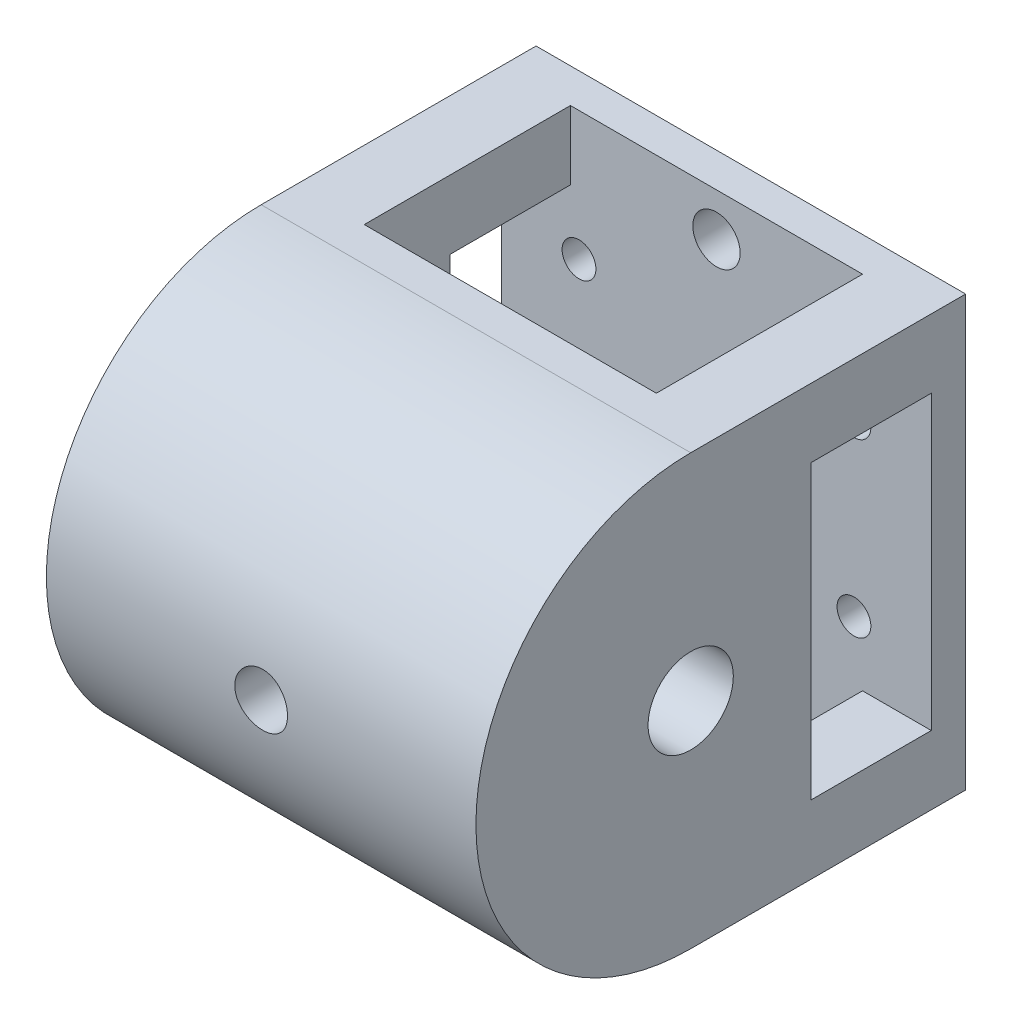
from build123d import *

# Parameters (mm, degrees)
SKETCH1_R               = 3.15
BOSS_EXTRUDE1_DEPTH     = 31.75
SKETCH4_W               = 8.89
SKETCH4_H               = 21.59
CUT_EXTRUDE1_DEPTH      = 41.902084605
SKETCH2_R               = 1.25
CUT_EXTRUDE2_DEPTH      = 2.54
SKETCH5_W               = 21.59
SKETCH5_H               = 8.89
CUT_EXTRUDE3_DEPTH      = 50.285164096
SKETCH6_R               = 1.75
CUT_EXTRUDE4_DEPTH      = 2.54
CUT_EXTRUDE5_REACH      = 81.487
CUT_EXTRUDE5_END_RADIUS = 3.15
SKETCH7_R               = 1.95
CUT_EXTRUDE6_DEPTH      = 6.35


with BuildPart() as part:
    # Sketch1 → Boss-Extrude1 (new body)
    with BuildSketch(Plane(origin=(0, 0, 0), x_dir=(0, 0, -1), z_dir=(1, 0, 0))):
        with BuildLine():
            Line((20.32, 15.875), (0, 15.875))
            ThreePointArc((0, 15.875), (-15.875, 0), (0, -15.875))
            Line((0, -15.875), (20.32, -15.875))
            Line((20.32, -15.875), (20.32, 15.875))
        make_face()
        Circle(SKETCH1_R, mode=Mode.SUBTRACT)
    extrude(amount=BOSS_EXTRUDE1_DEPTH)

    # Sketch4 → Cut-Extrude1 (cut, through all)
    with BuildSketch(Plane.ZY):
        with Locations((-13.335, 0)):
            Rectangle(SKETCH4_W, SKETCH4_H)
    extrude(amount=-CUT_EXTRUDE1_DEPTH, mode=Mode.SUBTRACT)

    # Sketch2 → Cut-Extrude2 (cut)
    with BuildSketch(Plane(origin=(0, 0, -20.32), x_dir=(-1, 0, 0), z_dir=(0, 0, -1))):
        with Locations((-26.035, 6.35)):
            Circle(SKETCH2_R)
        with Locations((-5.715, 6.35)):
            Circle(SKETCH2_R)
        with Locations((-5.715, -6.35)):
            Circle(SKETCH2_R)
        with Locations((-26.035, -6.35)):
            Circle(SKETCH2_R)
    extrude(amount=-CUT_EXTRUDE2_DEPTH, mode=Mode.SUBTRACT)

    # Sketch5 → Cut-Extrude3 (cut, through all)
    with BuildSketch(Plane(origin=(0, 15.875, 0), x_dir=(1, 0, 0), z_dir=(0, 1, 0))):
        with Locations((15.875, 13.335)):
            Rectangle(SKETCH5_W, SKETCH5_H)
    extrude(amount=-CUT_EXTRUDE3_DEPTH, mode=Mode.SUBTRACT)

    # Sketch6 → Cut-Extrude4 (cut)
    with BuildSketch(Plane(origin=(0, 0, -20.32), x_dir=(-1, 0, 0), z_dir=(0, 0, -1))):
        with Locations((-15.875, 12.7)):
            Circle(SKETCH6_R)
        with Locations((-15.875, -12.7)):
            Circle(SKETCH6_R)
    extrude(amount=-CUT_EXTRUDE4_DEPTH, mode=Mode.SUBTRACT)

    # Cut-Extrude5: up to this cylinder (the profile starts outside it)
    cut_extrude5_end = Plane(origin=(15.875, 0, 0), z_dir=(-1, 0, 0)) * Cylinder(CUT_EXTRUDE5_END_RADIUS, 170.274, mode=Mode.PRIVATE)
    # Sketch7 → Cut-Extrude5 (cut, up to the surface)
    with BuildSketch(Plane.XY.offset(50.8), mode=Mode.PRIVATE) as cut_extrude5_sk1:
        with Locations((15.875, 0)):
            Circle(SKETCH7_R)
    cut_extrude5_tool1 = extrude(cut_extrude5_sk1.sketch, amount=-CUT_EXTRUDE5_REACH, mode=Mode.PRIVATE) - cut_extrude5_end
    add(cut_extrude5_tool1.solids().sort_by_distance((15.875, 0, 50.8))[0], mode=Mode.SUBTRACT)

    # Sketch8 → Cut-Extrude6 (cut)
    with BuildSketch(Plane(origin=(0, 0, -8.89), x_dir=(-1, 0, 0), z_dir=(0, 0, -1))):
        Polygon((-26.67, 9.525), (-5.08, 9.525), (-5.08, 10.795), (-5.08, 15.875), (-26.67, 15.875), (-26.67, 10.795), align=None)
        Polygon((-26.67, -9.525), (-5.08, -9.525), (-5.08, -10.795), (-5.08, -15.875), (-26.67, -15.875), (-26.67, -10.795), align=None)
    extrude(amount=-CUT_EXTRUDE6_DEPTH, mode=Mode.SUBTRACT)


solid = part.part
